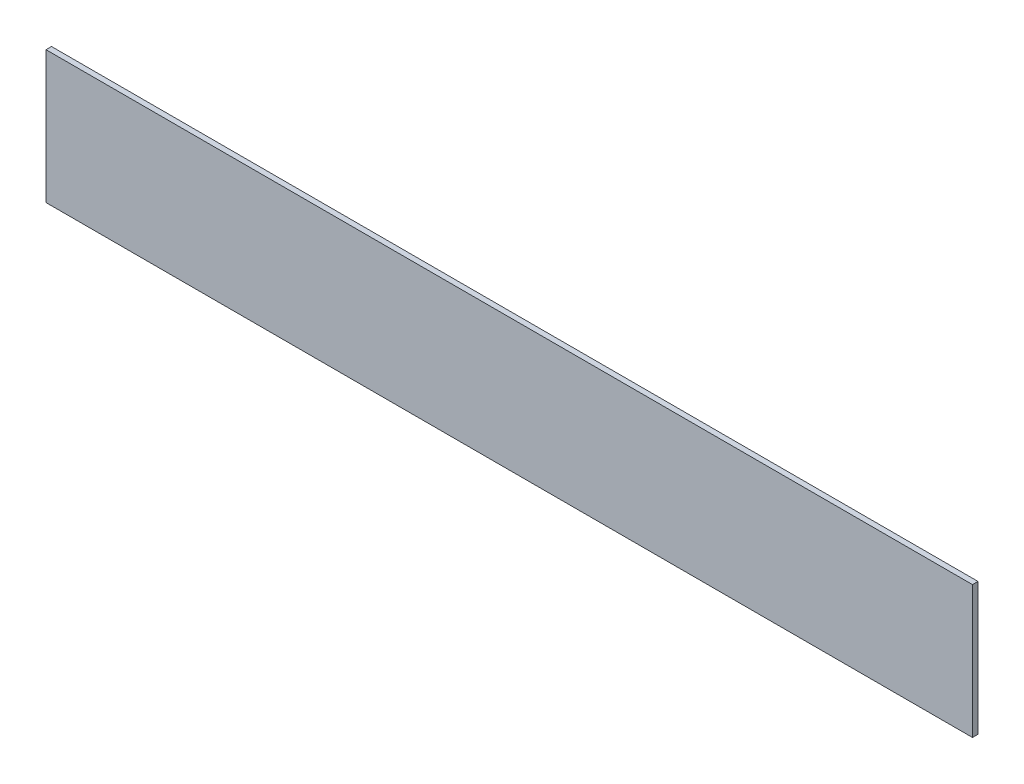
from build123d import *

# Parameters (mm, degrees)
SKETCH1_W           = 533.146
SKETCH1_H           = 76.2
BOSS_EXTRUDE1_DEPTH = 3.175


with BuildPart() as part:
    # Sketch1 → Boss-Extrude1 (new body)
    with BuildSketch(Plane(origin=(0, -330.2, 0), x_dir=(1, 0, 0), z_dir=(0, 0, 1))):
        with Locations((19.368396109, 6574.00722403)):
            Rectangle(SKETCH1_W, SKETCH1_H)
    extrude(amount=BOSS_EXTRUDE1_DEPTH)


solid = part.part
